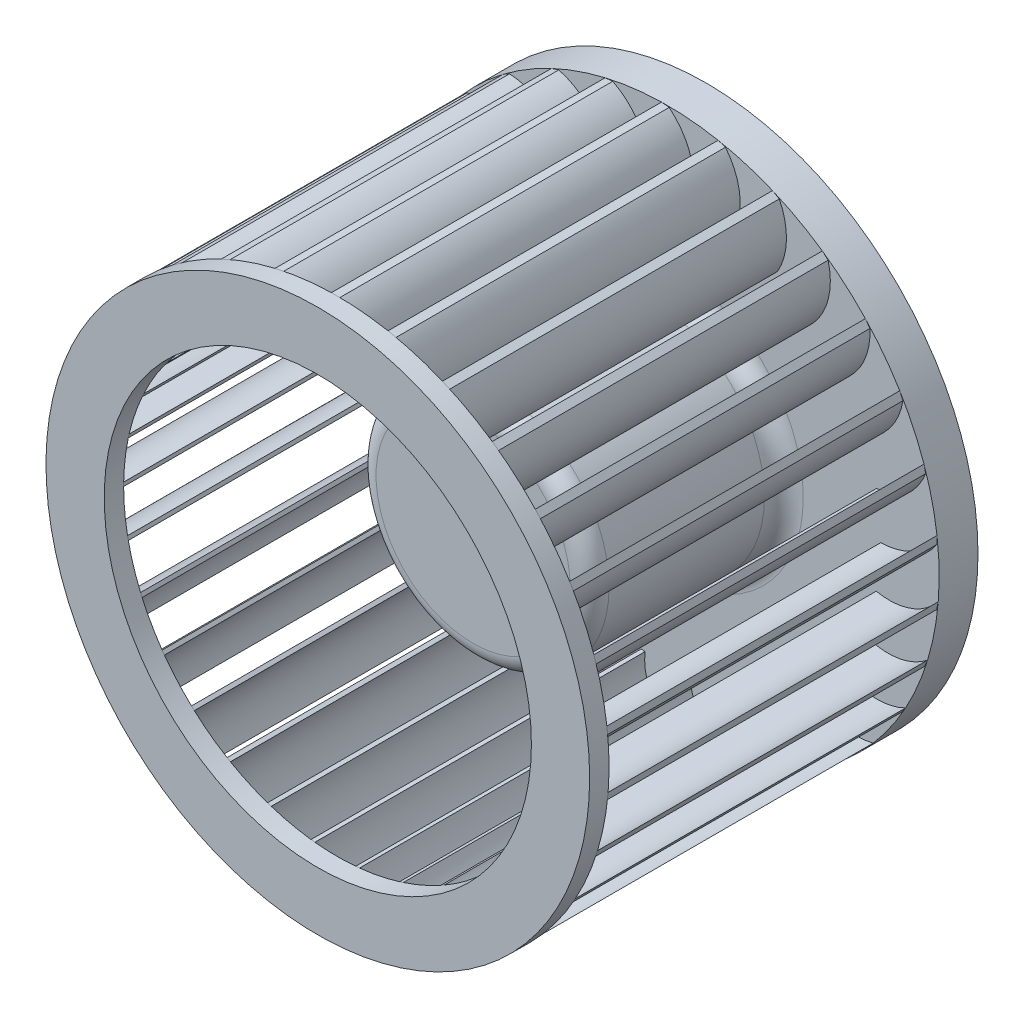
from build123d import *

# Parameters (mm, degrees)
SKETCH2_R           = 14
BOSS_EXTRUDE1_DEPTH = 2
SKETCH7_R           = 6
BOSS_EXTRUDE2_DEPTH = 10
BOSS_EXTRUDE3_DEPTH = 17
CIRPATTERN1_COUNT   = 30
SKETCH9_R           = 14
SKETCH9_R_2         = 11
BOSS_EXTRUDE4_DEPTH = 1
FILLET2_R           = 1


with BuildPart() as part:
    # Sketch2 → Boss-Extrude1 (new body)
    with BuildSketch(Plane.XY):
        Circle(SKETCH2_R)
    extrude(amount=BOSS_EXTRUDE1_DEPTH)

    # Sketch7 → Boss-Extrude2 (add)
    with BuildSketch(Plane.XY.offset(2)):
        Circle(SKETCH7_R)
    extrude(amount=BOSS_EXTRUDE2_DEPTH)

    # Sketch8 → Boss-Extrude3 (add)
    with BuildSketch(Plane.XY.offset(2)):
        with BuildLine():
            Line((13.888810578, 1.760948811), (13.888810578, 1.363926448))
            ThreePointArc((13.888810578, 1.363926448), (12.642489916, 0.21607072), (11, -0.2))
            Line((11, -0.2), (11, 0))
            ThreePointArc((11, 0), (12.691609239, 0.474939968), (13.888810578, 1.760948811))
        make_face()
    boss_extrude3 = extrude(amount=BOSS_EXTRUDE3_DEPTH)

    # CirPattern1: Boss-Extrude3 ×30 about axis
    cirpattern1_axis = Axis((0, 0, 0), (0, 0, 1))
    for i in range(1, CIRPATTERN1_COUNT):
        add(boss_extrude3.rotate(cirpattern1_axis, i * 360 / CIRPATTERN1_COUNT))

    # Sketch9 → Boss-Extrude4 (add)
    with BuildSketch(Plane.XY.offset(19)):
        with Locations(Location((0, 0, 0), (0, 0, 175.225920873))):
            Circle(SKETCH9_R)
        Circle(SKETCH9_R_2, mode=Mode.SUBTRACT)
    extrude(amount=BOSS_EXTRUDE4_DEPTH)

    # Fillet2
    fillet2_edges = [part.edges().sort_by_distance(p)[0] for p in [
        (-6, 0, 2),
        (-6, 0, 12),
    ]]
    fillet(fillet2_edges, radius=FILLET2_R)


solid = part.part
